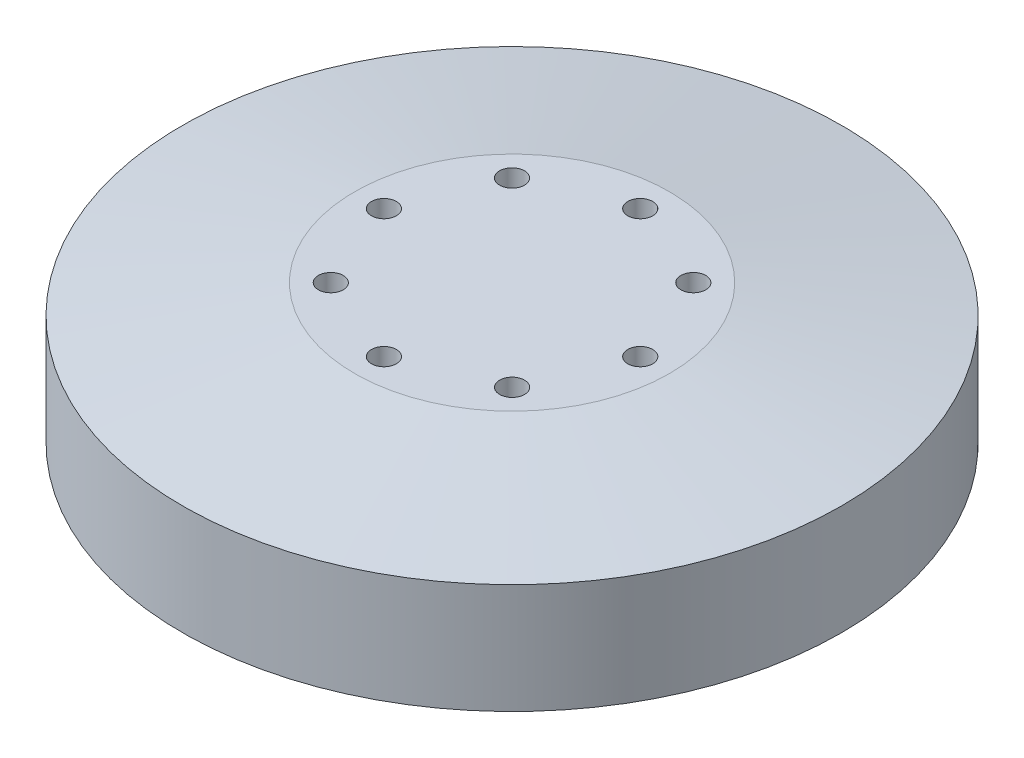
from build123d import *

# Parameters (mm, degrees)
SKETCH2_R                = 43
CUT_EXTRUDE1_DEPTH       = 1
M3_CLEARANCE_HOLE1_D     = 3.4
M3_CLEARANCE_HOLE1_DEPTH = 4
M3_CLEARANCE_HOLE1_TIP   = 1.021463052


with BuildPart() as part:
    # Sketch1 → Revolve1 (revolve)
    with BuildSketch(Plane.XY, mode=Mode.PRIVATE) as revolve1_sk:
        Polygon((0, -9.45), (0, 9.45), (-21.5, 9.45), (-45, 5.55), (-45, -9.45), align=None)
    revolve(revolve1_sk.sketch.rotate(Axis((0, -9.45, 0), (0, 1, 0)), 180), axis=Axis((0, -9.45, 0), (0, 1, 0)))

    # Sketch2 → Cut-Extrude1 (cut)
    with BuildSketch(Plane.XZ.offset(9.45)):
        Circle(SKETCH2_R)
    extrude(amount=-CUT_EXTRUDE1_DEPTH, mode=Mode.SUBTRACT)

    # M3 Clearance Hole1
    with Locations(Plane(origin=(0, 9.45, 0), x_dir=(1, 0, 0), z_dir=(0, 1, 0))):
        with Locations((0, 17.5), (-12.374368671, 12.374368671), (-17.5, 0), (-12.374368671, -12.374368671), (0, -17.5), (12.374368671, -12.374368671), (17.5, 0), (12.374368671, 12.374368671)):
            Hole(M3_CLEARANCE_HOLE1_D / 2, depth=M3_CLEARANCE_HOLE1_DEPTH)
            with Locations((0, 0, -(M3_CLEARANCE_HOLE1_DEPTH + M3_CLEARANCE_HOLE1_TIP / 2))):  # 118° drill point
                Cone(0, M3_CLEARANCE_HOLE1_D / 2, M3_CLEARANCE_HOLE1_TIP, mode=Mode.SUBTRACT)


solid = part.part
